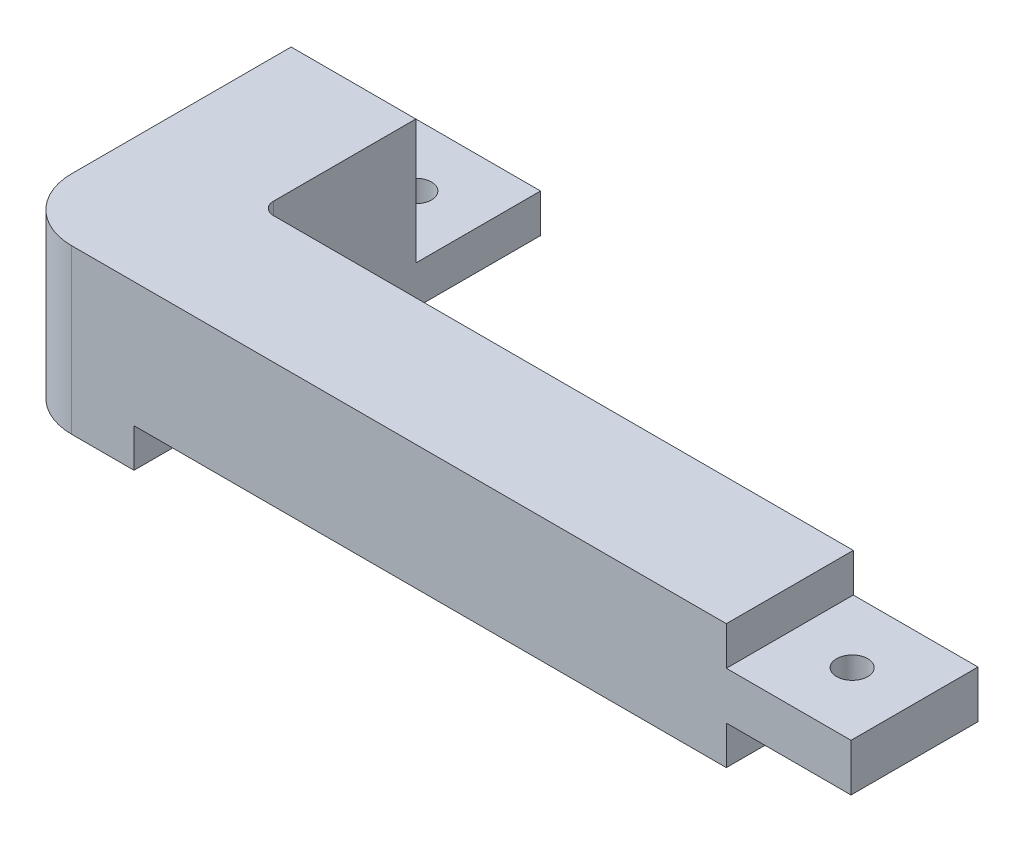
from build123d import *

# Parameters (mm, degrees)
SKETCH1_W           = 25.4
SKETCH1_H           = 82.804
BOSS_EXTRUDE1_DEPTH = 33.274
SKETCH3_W           = 25.859634715
SKETCH3_H           = 25.4
BOSS_EXTRUDE2_DEPTH = 120.65
SKETCH8_W           = 25.4
SKETCH8_H           = 25.4
CUT_EXTRUDE5_DEPTH  = 25.4
SKETCH5_W           = 25.859634715
SKETCH5_H           = 9.652
BOSS_EXTRUDE3_DEPTH = 25.4
SKETCH7_R           = 3.175
CUT_EXTRUDE4_DEPTH  = 41.402
FILLET1_R           = 12.7
FILLET2_R           = 2.54
SKETCH9_R           = 3.175
CUT_EXTRUDE6_DEPTH  = 25.4


with BuildPart() as part:
    # Sketch1 → Boss-Extrude1 (new body)
    with BuildSketch(Plane(origin=(0, 0, 0), x_dir=(1, 0, 0), z_dir=(0, 1, 0))):
        with Locations((13.650196891, -15.542365285)):
            Rectangle(SKETCH1_W, SKETCH1_H)
    extrude(amount=BOSS_EXTRUDE1_DEPTH)

    # Sketch3 → Boss-Extrude2 (add)
    with BuildSketch(Plane(origin=(26.350196891, 0, 0), x_dir=(0, 0, -1), z_dir=(1, 0, 0))):
        with Locations((-44.014547928, 20.574)):
            Rectangle(SKETCH3_W, SKETCH3_H)
    extrude(amount=BOSS_EXTRUDE2_DEPTH)

    # Sketch8 → Cut-Extrude5 (cut)
    with BuildSketch(Plane(origin=(0, 0, -25.859634715), x_dir=(-1, 0, 0), z_dir=(0, 0, -1))):
        with Locations((-13.650196891, 20.574)):
            Rectangle(SKETCH8_W, SKETCH8_H)
    extrude(amount=-CUT_EXTRUDE5_DEPTH, mode=Mode.SUBTRACT)

    # Sketch5 → Boss-Extrude3 (add)
    with BuildSketch(Plane(origin=(147.000196891, 0, 0), x_dir=(0, 0, -1), z_dir=(1, 0, 0))):
        with Locations((-44.014547928, 20.574)):
            Rectangle(SKETCH5_W, SKETCH5_H)
    extrude(amount=BOSS_EXTRUDE3_DEPTH)

    # Sketch7 → Cut-Extrude4 (cut)
    with BuildSketch(Plane(origin=(0, 25.4, 0), x_dir=(1, 0, 0), z_dir=(0, 1, 0))):
        with Locations(Location((159.700196891, -44.014547927, 0), (0, 0, 270))):
            Circle(SKETCH7_R)
    extrude(amount=-CUT_EXTRUDE4_DEPTH, mode=Mode.SUBTRACT)

    # Fillet1
    fillet1_edges = [part.edges().sort_by_distance(p)[0] for p in [
        (0.950196891, 16.637, 56.944365285),
    ]]
    fillet(fillet1_edges, radius=FILLET1_R)

    # Fillet2
    fillet2_edges = [part.edges().sort_by_distance(p)[0] for p in [
        (26.350196891, 20.574, 31.08473057),
    ]]
    fillet(fillet2_edges, radius=FILLET2_R)

    # Sketch9 → Cut-Extrude6 (cut)
    with BuildSketch(Plane(origin=(0, 7.874, 0), x_dir=(1, 0, 0), z_dir=(0, 1, 0))):
        with Locations(Location((13.650196891, 13.159634715, 0), (0, 0, 270))):
            Circle(SKETCH9_R)
    extrude(amount=-CUT_EXTRUDE6_DEPTH, mode=Mode.SUBTRACT)


solid = part.part
